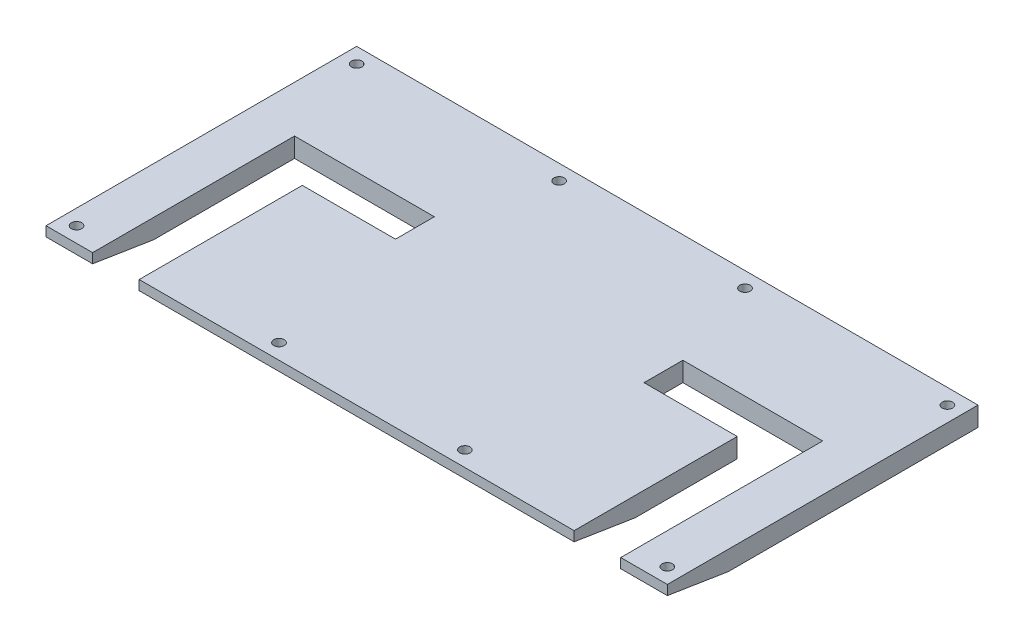
from build123d import *

# Parameters (mm, degrees)
BOSS_EXTRUDE1_DEPTH = 6.35
SKETCH2_R           = 1.7
CUT_EXTRUDE1_DEPTH  = 128.158650905
CUT_EXTRUDE2_DEPTH  = 128.158650905
BOSS_EXTRUDE2_DEPTH = 50.8


with BuildPart() as part:
    # Sketch1 → Boss-Extrude1 (new body)
    with BuildSketch(Plane(origin=(0, 0, 0), x_dir=(1, 0, 0), z_dir=(0, 1, 0))):
        Polygon((15.24, 53.34), (15.24, 66.04), (60.96, 66.04), (60.96, 0), (76.2, 0), (76.2, 101.6), (0, 101.6), (0, 0), (10, 0), (45.72, 0), (45.72, 53.34), align=None)
    extrude(amount=BOSS_EXTRUDE1_DEPTH)

    # Sketch2 → Cut-Extrude1 (cut, through all)
    with BuildSketch(Plane(origin=(0, 6.35, 0), x_dir=(1, 0, 0), z_dir=(0, 1, 0))):
        with Locations(Location((5, 96.6, 0), (0, 0, 270))):
            Circle(SKETCH2_R)
        with Locations(Location((71.2, 96.6, 0), (0, 0, 90))):
            Circle(SKETCH2_R)
        with Locations(Location((71.2, 5, 0), (0, 0, 270))):
            Circle(SKETCH2_R)
        with Locations(Location((5, 5, 0), (0, 0, 90))):
            Circle(SKETCH2_R)
    extrude(amount=-CUT_EXTRUDE1_DEPTH, mode=Mode.SUBTRACT)

    # Sketch3 → Cut-Extrude2 (cut, through all)
    with BuildSketch(Plane.ZY):
        Polygon((0, 3.175), (-20, 0), (0, 0), align=None)
    extrude(amount=-CUT_EXTRUDE2_DEPTH, mode=Mode.SUBTRACT)


with BuildPart() as body_2:
    # Mirror1: mirrored copy
    add(part.part.mirror(Plane.ZY.offset(25.4)))


with BuildPart() as part_1:
    add(part.part)

    add(body_2.part)  # Boss-Extrude2 merges body 2
    # Sketch4 → Boss-Extrude2 (add)
    with BuildSketch(Plane(origin=(-50.8, 0, 0), x_dir=(0, 0, -1), z_dir=(1, 0, 0))):
        Polygon((0, 6.35), (101.6, 6.35), (101.6, 0), (20, 0), (0, 3.175), align=None)
    extrude(amount=BOSS_EXTRUDE2_DEPTH)


solid = part_1.part
